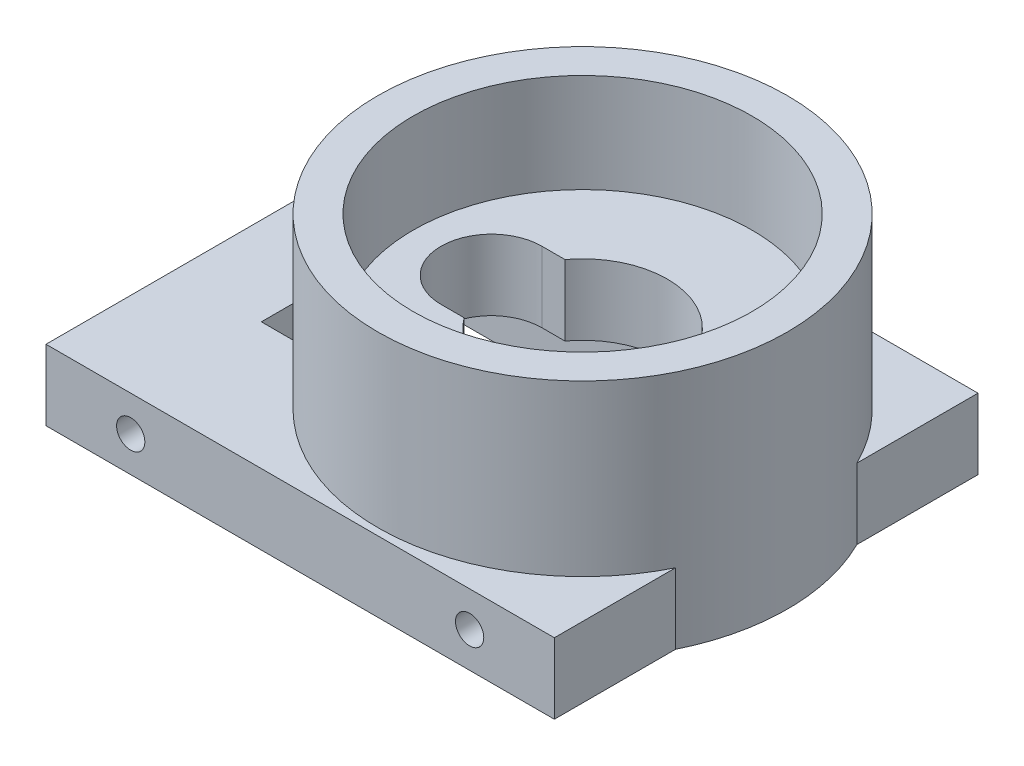
from build123d import *

# Parameters (mm, degrees)
SKETCH_1_W               = 36
SKETCH_1_H               = 30
EXTRUDE_1_DEPTH          = 5
SKETCH_2_R               = 14.5
EXTRUDE_2_DEPTH          = 17
SKETCH_4_W               = 33
SKETCH_4_H               = 12
CUT_EXTRUDE_2_DEPTH      = 2
SKETCH_8_R               = 1
CUT_EXTRUDE_6_DEPTH      = 3
CUT_EXTRUDE_3_DEPTH      = 29.814059068
CUT_EXTRUDE_3_DEPTH_BACK = 3
SKETCH_5_W               = 23.5
SKETCH_5_H               = 12
SKETCH_3_R               = 12
CUT_EXTRUDE_1_DEPTH      = 7
SKETCH_6_R               = 6
CUT_EXTRUDE_4_DEPTH      = 5
CUT_EXTRUDE_5_DEPTH      = 5
SKETCH_9_R               = 1
CUT_EXTRUDE_7_DEPTH      = 5


with BuildPart() as part:
    # 草图1 → 凸台-拉伸1 (new body)
    with BuildSketch(Plane(origin=(0, 0, 0), x_dir=(1, 0, 0), z_dir=(0, 1, 0))):
        Rectangle(SKETCH_1_W, SKETCH_1_H)
    extrude(amount=EXTRUDE_1_DEPTH)

    # 草图2 → 凸台-拉伸2 (add)
    with BuildSketch(Plane.XZ):
        with Locations(Location((5, 0, 0), (0, 0, 270))):
            Circle(SKETCH_2_R)
    extrude(amount=-EXTRUDE_2_DEPTH)

    # 草图4 → 切除-拉伸2 (cut)
    with BuildSketch(Plane.XZ):
        Rectangle(SKETCH_4_W, SKETCH_4_H)
    extrude(amount=-CUT_EXTRUDE_2_DEPTH, mode=Mode.SUBTRACT)

    # 草图8 → 切除-拉伸6 (cut)
    with BuildSketch(Plane.XZ.offset(-2)):
        with Locations(Location((14, 0, 0), (0, 0, 270))):
            Circle(SKETCH_8_R)
        with Locations(Location((-14, 0, 0), (0, 0, 270))):
            Circle(SKETCH_8_R)
    extrude(amount=-CUT_EXTRUDE_6_DEPTH, mode=Mode.SUBTRACT)

    # 草图5 → 切除-拉伸3 (cut, two sides: drawn at the far end of the back side and taken through both)
    with BuildSketch(Plane.XZ.offset(-2).offset(-CUT_EXTRUDE_3_DEPTH_BACK)):
        Rectangle(SKETCH_5_W, SKETCH_5_H)
    extrude(amount=CUT_EXTRUDE_3_DEPTH + CUT_EXTRUDE_3_DEPTH_BACK, mode=Mode.SUBTRACT)

    # 草图3 → 切除-拉伸1 (cut)
    with BuildSketch(Plane(origin=(0, 17, 0), x_dir=(1, 0, 0), z_dir=(0, 1, 0))):
        with Locations(Location((5, 0, 0), (0, 0, 270))):
            Circle(SKETCH_3_R)
    extrude(amount=-CUT_EXTRUDE_1_DEPTH, mode=Mode.SUBTRACT)

    # 草图6 → 切除-拉伸4 (cut)
    with BuildSketch(Plane(origin=(0, 10, 0), x_dir=(1, 0, 0), z_dir=(0, 1, 0))):
        with Locations(Location((5, 0, 0), (0, 0, 270))):
            Circle(SKETCH_6_R)
    extrude(amount=-CUT_EXTRUDE_4_DEPTH, mode=Mode.SUBTRACT)

    # 草图7 → 切除-拉伸5 (cut)
    with BuildSketch(Plane(origin=(0, 10, 0), x_dir=(1, 0, 0), z_dir=(0, 1, 0))):
        with BuildLine():
            Line((-1.455492537, 3.570915288), (2.115422752, 3.570915288))
            Line((2.115422752, 3.570915288), (2.115422752, -3.570915288))
            Line((2.115422752, -3.570915288), (-1.455492537, -3.570915288))
            ThreePointArc((-1.455492537, -3.570915288), (-5.026407825, 0), (-1.455492537, 3.570915288))
        make_face()
    extrude(amount=-CUT_EXTRUDE_5_DEPTH, mode=Mode.SUBTRACT)

    # 草图9 → 切除-拉伸7 (cut)
    with BuildSketch(Plane(origin=(0, 0, -15), x_dir=(-1, 0, 0), z_dir=(0, 0, -1))):
        with Locations((12, 2.5)):
            Circle(SKETCH_9_R)
        with Locations(Location((-12, 2.5, 0), (0, 0, 180))):
            Circle(SKETCH_9_R)
    cut_extrude_7 = extrude(amount=-CUT_EXTRUDE_7_DEPTH, mode=Mode.SUBTRACT)

    # 镜向1: 切除-拉伸7 across plane
    add(cut_extrude_7.mirror(Plane.XY), mode=Mode.SUBTRACT)


solid = part.part
